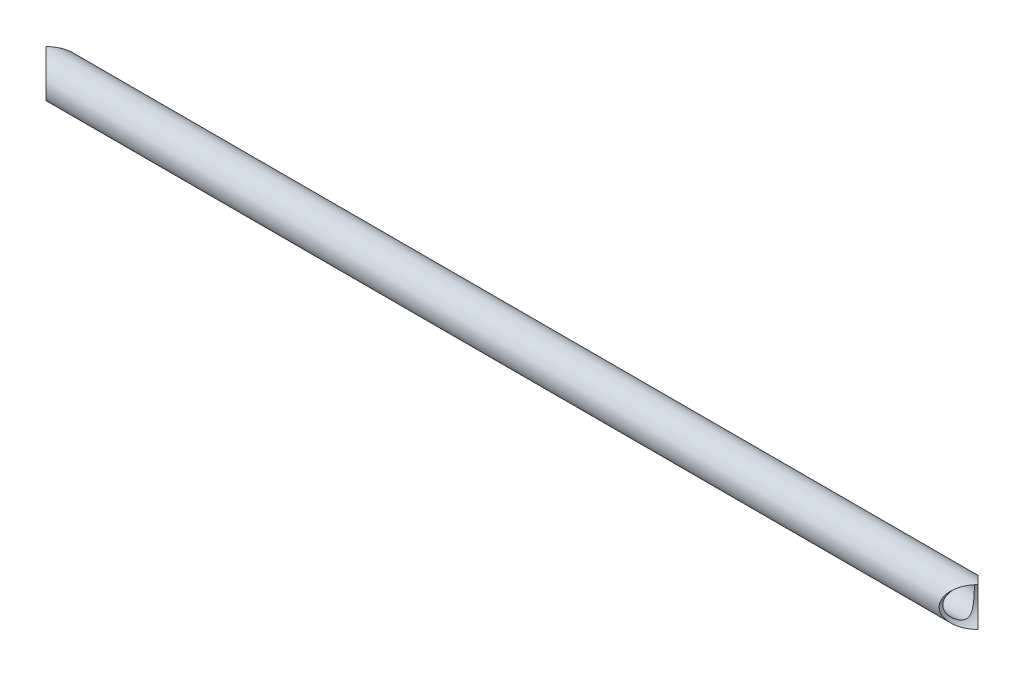
from build123d import *

# Parameters (mm, degrees)
SKETCH1_R                          = 7.9375
SKETCH1_R_2                        = 6.4375
PIPE_CONFIGURED_21_3_X_2_3_7_DEPTH = 380.814777714
CORTE_EXTRUS_O1_DEPTH              = 907.343202597
CORTE_EXTRUS_O1_DEPTH_BACK         = 907.343202597
ESBO_O17_R                         = 7.9375


with BuildPart() as part:
    # Sketch1 → Pipe - configured 21.3 X 2.3(7) (new body)
    with BuildSketch(Plane(origin=(854.389836714, 250, 150), x_dir=(0, 0, 1), z_dir=(-1, 0, 0))):
        Circle(SKETCH1_R)
        Circle(SKETCH1_R_2, mode=Mode.SUBTRACT)
    extrude(amount=PIPE_CONFIGURED_21_3_X_2_3_7_DEPTH)

    # Esboço17 → Corte-extrusão1 (cut, two sides: drawn at the far end of the back side and taken through both)
    with BuildSketch(Plane.XY.offset(-CORTE_EXTRUS_O1_DEPTH_BACK)):
        with Locations((473.575059, 250)):
            Circle(ESBO_O17_R)
        with Locations((854.389836714, 250)):
            Circle(ESBO_O17_R)
    extrude(amount=CORTE_EXTRUS_O1_DEPTH + CORTE_EXTRUS_O1_DEPTH_BACK, mode=Mode.SUBTRACT)


solid = part.part
